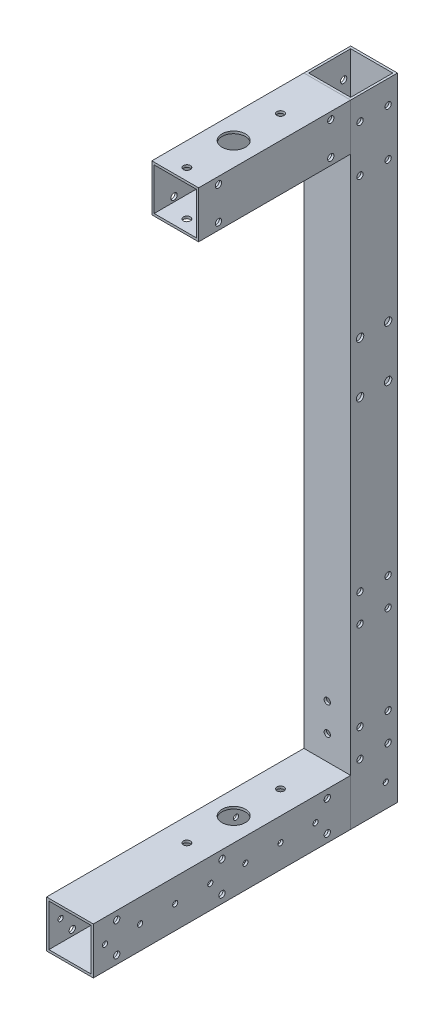
from build123d import *

# Parameters (mm, degrees)
SKETCH1_W                = 20
SKETCH1_H                = 20
SKETCH1_W_2              = 18
SKETCH1_H_2              = 18
F_25_X_10_X_1_1_DEPTH    = 270
SKETCH1_ON_SEGMENT_2_W   = 20
SKETCH1_ON_SEGMENT_2_H   = 20
SKETCH1_ON_SEGMENT_2_W_2 = 18
SKETCH1_ON_SEGMENT_2_H_2 = 18
F_25_X_10_X_1_1_2_DEPTH  = 76
SKETCH12_W               = 20
SKETCH12_H               = 20
SKETCH12_W_2             = 18
SKETCH12_H_2             = 18
F_20_X_20_X_2_3_DEPTH    = 120
CUT_EXTRUDE_START        = -1
SKETCH_4_R               = 1.5
CUT_EXTRUDE_1_DEPTH      = 251
SKETCH_5_R               = 5
CUT_EXTRUDE_2_DEPTH      = 251
SKETCH_6_R               = 1.5
SKETCH_6_R_2             = 5
CUT_EXTRUDE_3_DEPTH      = 1
SKETCH_9_R               = 1.35
SKETCH_9_R_2             = 1.1
CUT_EXTRUDE_6_DEPTH      = 297.141857899
SKETCH_12_R              = 1.35
CUT_EXTRUDE_7_DEPTH      = 300.833287011
SKETCH_15_R              = 1.6
CUT_EXTRUDE_8_DEPTH      = 297.141857899


with BuildPart() as part:
    # Sketch1 → 方形管 25 X 10 X 1(1) (new body)
    with BuildSketch(Plane(origin=(0, 0, 0), x_dir=(1, 0, 0), z_dir=(0, 1, 0))):
        Rectangle(SKETCH1_W, SKETCH1_H)
        Rectangle(SKETCH1_W_2, SKETCH1_H_2, mode=Mode.SUBTRACT)
    extrude(amount=F_25_X_10_X_1_1_DEPTH)


with BuildPart() as body_2:
    # Sketch1 on segment 2 (carried to segment 2) → 25 X 10 X 1_1 2 (new body)
    with BuildSketch(Plane(origin=(0, 260, -1), x_dir=(1, 0, 0), z_dir=(0, 0, 1))):
        Rectangle(SKETCH1_ON_SEGMENT_2_W, SKETCH1_ON_SEGMENT_2_H)
        Rectangle(SKETCH1_ON_SEGMENT_2_W_2, SKETCH1_ON_SEGMENT_2_H_2, mode=Mode.SUBTRACT)
    extrude(amount=F_25_X_10_X_1_1_2_DEPTH)

    # 25 X 10 X 1_1 2 end butt 1
    split(bisect_by=Plane(origin=(0, 260, 10), x_dir=(0, -1, 0), z_dir=(0, 0, 1)), keep=Keep.TOP)


with BuildPart() as body_3:
    # Sketch12 → 方形管 20 X 20 X 2(3) (new body)
    with BuildSketch(Plane(origin=(0, 10, 0), x_dir=(1, 0, 0), z_dir=(0, 0, 1))):
        Rectangle(SKETCH12_W, SKETCH12_H)
        Rectangle(SKETCH12_W_2, SKETCH12_H_2, mode=Mode.SUBTRACT)
    extrude(amount=F_20_X_20_X_2_3_DEPTH)

    # Weld Trim 2
    split(bisect_by=Plane(origin=(0, 135, 10), x_dir=(0, -1, 0), z_dir=(0, 0, 1)), keep=Keep.TOP)


with BuildPart() as cut_extrude_1_tool:
    # 草图4 → 切除-拉伸1 (new body)
    with BuildSketch(Plane.XZ.offset(-250).offset(CUT_EXTRUDE_START)):
        with Locations(Location((0, 70, 0), (0, 0, 90))):
            Circle(SKETCH_4_R)
        with Locations(Location((0, 30, 0), (0, 0, 90))):
            Circle(SKETCH_4_R)
    extrude(amount=CUT_EXTRUDE_1_DEPTH)


with BuildPart() as body_2_1:
    add(body_2.part)

    # 切除-拉伸1: cut by cut_extrude_1_tool
    add(cut_extrude_1_tool.part, mode=Mode.SUBTRACT)


with BuildPart() as body_3_1:
    add(body_3.part)

    # 切除-拉伸1: cut by cut_extrude_1_tool
    add(cut_extrude_1_tool.part, mode=Mode.SUBTRACT)


with BuildPart() as cut_extrude_2_tool:
    # 草图5 → 切除-拉伸2 (new body)
    with BuildSketch(Plane.XZ.offset(-250).offset(CUT_EXTRUDE_START)):
        with Locations(Location((0, 50, 0), (0, 0, 90))):
            Circle(SKETCH_5_R)
    extrude(amount=CUT_EXTRUDE_2_DEPTH)


with BuildPart() as body_2_2:
    add(body_2_1.part)

    # 切除-拉伸2: cut by cut_extrude_2_tool
    add(cut_extrude_2_tool.part, mode=Mode.SUBTRACT)

    # 草图6 → 切除-拉伸3 (cut)
    with BuildSketch(Plane(origin=(0, 270, 0), x_dir=(1, 0, 0), z_dir=(0, 1, 0))):
        with Locations(Location((0, -30, 0), (0, 0, 270))):
            Circle(SKETCH_6_R)
        with Locations(Location((0, -50, 0), (0, 0, 270))):
            Circle(SKETCH_6_R_2)
        with Locations(Location((0, -70, 0), (0, 0, 270))):
            Circle(SKETCH_6_R)
    extrude(amount=-CUT_EXTRUDE_3_DEPTH, mode=Mode.SUBTRACT)


with BuildPart() as body_3_2:
    add(body_3_1.part)

    # 切除-拉伸2: cut by cut_extrude_2_tool
    add(cut_extrude_2_tool.part, mode=Mode.SUBTRACT)


with BuildPart() as cut_extrude_6_tool:
    # 草图9 → 切除-拉伸6 (new, through all)
    with BuildSketch(Plane.ZY.offset(10)):
        with Locations((-6, 74)):
            Circle(SKETCH_9_R)
        with Locations((-6, 240)):
            Circle(SKETCH_9_R)
        with Locations((-6, 86)):
            Circle(SKETCH_9_R)
        with Locations((6, 86)):
            Circle(SKETCH_9_R)
        with Locations((6, 74)):
            Circle(SKETCH_9_R)
        with Locations((6, 240)):
            Circle(SKETCH_9_R)
        with Locations((115, 10)):
            Circle(SKETCH_9_R_2)
        with Locations((100, 10)):
            Circle(SKETCH_9_R_2)
        with Locations((85, 10)):
            Circle(SKETCH_9_R_2)
        with Locations((70, 10)):
            Circle(SKETCH_9_R_2)
        with Locations((-6, 36)):
            Circle(SKETCH_9_R)
        with Locations((6, 36)):
            Circle(SKETCH_9_R)
        with Locations((-6, 24)):
            Circle(SKETCH_9_R)
        with Locations((6, -4)):
            Circle(SKETCH_9_R)
        with Locations((-6, -4)):
            Circle(SKETCH_9_R)
        with Locations((6, -16)):
            Circle(SKETCH_9_R)
        with Locations((-6, -16)):
            Circle(SKETCH_9_R)
        with Locations((6, 24)):
            Circle(SKETCH_9_R)
        with Locations((55, 10)):
            Circle(SKETCH_9_R_2)
        with Locations((40, 10)):
            Circle(SKETCH_9_R_2)
        with Locations((25, 10)):
            Circle(SKETCH_9_R_2)
        with Locations((-5, 10)):
            Circle(SKETCH_9_R_2)
        with Locations((20, 16.5)):
            Circle(SKETCH_9_R)
        with Locations((20, 3.5)):
            Circle(SKETCH_9_R)
        with Locations((-6, 260)):
            Circle(SKETCH_9_R)
        with Locations((6, 260)):
            Circle(SKETCH_9_R)
        with Locations((18.5, 267)):
            Circle(SKETCH_9_R)
        with Locations((66.5, 267)):
            Circle(SKETCH_9_R)
        with Locations((66.5, 253)):
            Circle(SKETCH_9_R)
        with Locations((18.5, 253)):
            Circle(SKETCH_9_R)
        with Locations((110, 3.5)):
            Circle(SKETCH_9_R)
        with Locations((110, 16.5)):
            Circle(SKETCH_9_R)
        with Locations((65, 16.5)):
            Circle(SKETCH_9_R)
        with Locations((65, 3.5)):
            Circle(SKETCH_9_R)
    extrude(amount=-CUT_EXTRUDE_6_DEPTH)


with BuildPart() as part_1:
    add(part.part)

    # 切除-拉伸6: cut by cut_extrude_6_tool
    add(cut_extrude_6_tool.part, mode=Mode.SUBTRACT)

    # 草图12 → 切除-拉伸7 (cut, through all)
    with BuildSketch(Plane(origin=(0, 0, -10), x_dir=(-1, 0, 0), z_dir=(0, 0, -1))):
        with Locations((0, 42.5)):
            Circle(SKETCH_12_R)
        with Locations(Location((0, 30.5, 0), (0, 0, 180))):
            Circle(SKETCH_12_R)
    extrude(amount=-CUT_EXTRUDE_7_DEPTH, mode=Mode.SUBTRACT)

    # 草图15 → 切除-拉伸8 (cut, through all)
    with BuildSketch(Plane(origin=(10, 0, 0), x_dir=(0, 0, -1), z_dir=(1, 0, 0))):
        with Locations((-6, 180)):
            Circle(SKETCH_15_R)
        with Locations((-6, 158)):
            Circle(SKETCH_15_R)
        with Locations(Location((6, 158, 0), (0, 0, 180))):
            Circle(SKETCH_15_R)
        with Locations(Location((6, 180, 0), (0, 0, 180))):
            Circle(SKETCH_15_R)
    extrude(amount=-CUT_EXTRUDE_8_DEPTH, mode=Mode.SUBTRACT)


with BuildPart() as body_2_3:
    add(body_2_2.part)

    # 切除-拉伸6: cut by cut_extrude_6_tool
    add(cut_extrude_6_tool.part, mode=Mode.SUBTRACT)


with BuildPart() as body_3_3:
    add(body_3_2.part)

    # 切除-拉伸6: cut by cut_extrude_6_tool
    add(cut_extrude_6_tool.part, mode=Mode.SUBTRACT)


solid = Compound([part_1.part, body_2_3.part, body_3_3.part])
